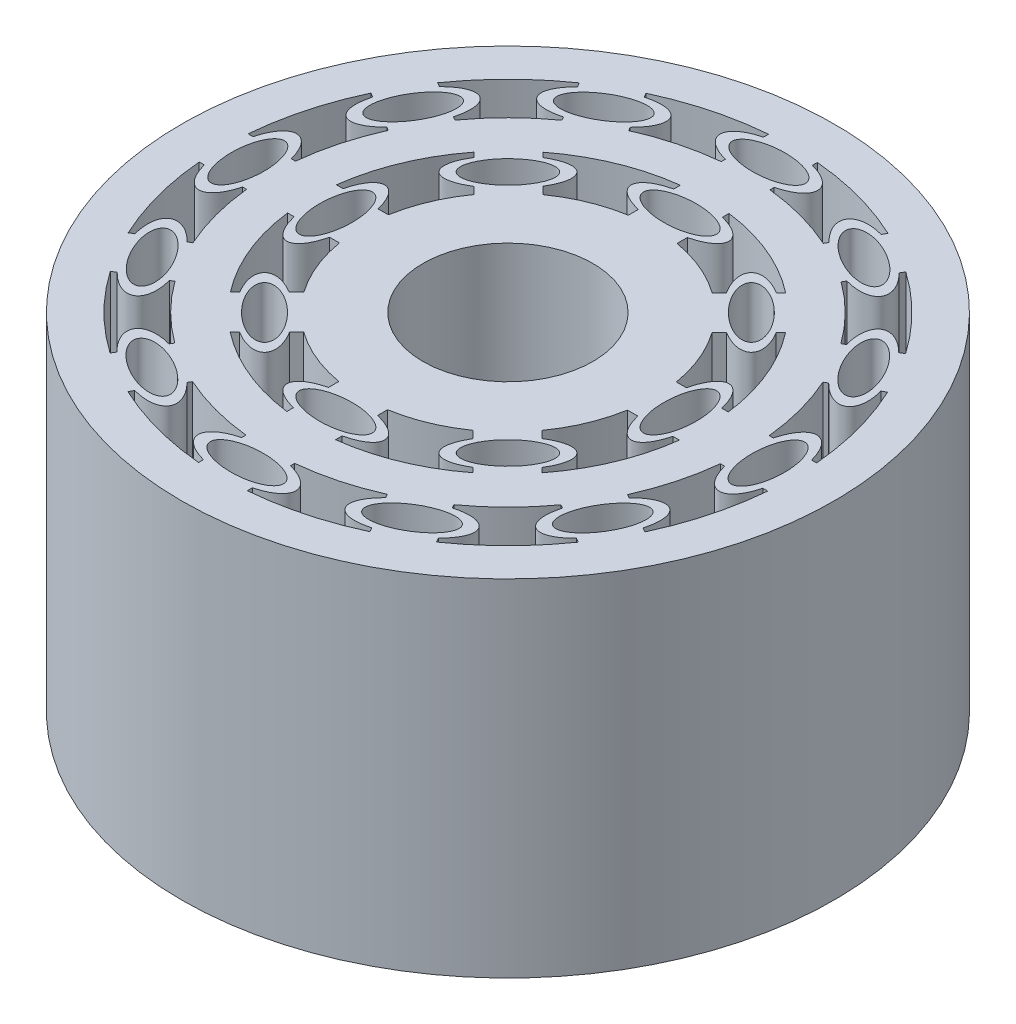
from build123d import *

# Parameters (mm, degrees)
SKETCH1_R            = 40.125
BOSS_EXTRUDE1_DEPTH  = 42.5
SKETCH2_R            = 35.125
CUT_EXTRUDE1_DEPTH   = 71.896271058
SKETCH3_R            = 29.325
BOSS_EXTRUDE2_DEPTH  = 42.5
SKETCH4_R            = 24.325
CUT_EXTRUDE2_DEPTH   = 71.896271058
BOSS_EXTRUDE6_DEPTH  = 42.5
SKETCH10_RX          = 4.5
SKETCH10_RY          = 2
CUT_EXTRUDE4_DEPTH   = 71.896271232
CIRPATTERN11_COUNT   = 12
SKETCH14_R           = 18
BOSS_EXTRUDE7_DEPTH  = 42.5
BOSS_EXTRUDE11_DEPTH = 42.5
SKETCH32_RX          = 4.5
SKETCH32_RY          = 2
CUT_EXTRUDE10_DEPTH  = 71.896271232
CIRPATTERN12_COUNT   = 8
SKETCH33_R           = 10.45
CUT_EXTRUDE11_DEPTH  = 71.896271232
SKETCH34_R           = 11
BOSS_EXTRUDE12_DEPTH = 2


with BuildPart() as part:
    # Sketch1 → Boss-Extrude1 (new body)
    with BuildSketch(Plane(origin=(0, 0, 0), x_dir=(1, 0, 0), z_dir=(0, 1, 0))):
        with Locations(Location((0, 0, 0), (0, 0, 270))):
            Circle(SKETCH1_R)
    extrude(amount=BOSS_EXTRUDE1_DEPTH)

    # Sketch2 → Cut-Extrude1 (cut, through all)
    with BuildSketch(Plane(origin=(0, 42.5, 0), x_dir=(1, 0, 0), z_dir=(0, 1, 0))):
        with Locations(Location((0, 0, 0), (0, 0, 270))):
            Circle(SKETCH2_R)
    extrude(amount=-CUT_EXTRUDE1_DEPTH, mode=Mode.SUBTRACT)



with BuildPart() as body_2:
    # Sketch3 → Boss-Extrude2 (new, through all)
    with BuildSketch(Plane(origin=(0, 0, 0), x_dir=(1, 0, 0), z_dir=(0, 1, 0))):
        with Locations(Location((0, 0, 0), (0, 0, 270))):
            Circle(SKETCH3_R)
    extrude(amount=BOSS_EXTRUDE2_DEPTH)

    # Sketch4 → Cut-Extrude2 (cut, through all)
    with BuildSketch(Plane(origin=(0, 42.5, 0), x_dir=(1, 0, 0), z_dir=(0, 1, 0))):
        with Locations(Location((0, 0, 0), (0, 0, 270))):
            Circle(SKETCH4_R)
    extrude(amount=-CUT_EXTRUDE2_DEPTH, mode=Mode.SUBTRACT)


with BuildPart() as part_1:
    add(part.part)

    add(body_2.part)  # Boss-Extrude6 merges body 2
    # Sketch5 → Boss-Extrude6 (add, through all)
    with BuildSketch(Plane(origin=(0, 42.5, 0), x_dir=(1, 0, 0), z_dir=(0, 1, 0))):
        with BuildLine():
            Line((-2.952538793, 34.381575863), (-2.952538793, 35.744981956))
            Line((-2.952538793, 35.744981956), (3.047461207, 35.744981956))
            Line((3.047461207, 35.744981956), (3.047461207, 34.381575863))
            add(Edge.make_bspline(
                [(3.047461207, 29.683388048), (12.047461207, 32.032481956), (3.047461207, 34.381575863)],
                knots=[2.094395102, 2.094395102, 2.094395102, 4.188790205, 4.188790205, 4.188790205], degree=2, weights=[1, 0.5, 1]))
            Line((3.047461207, 29.683388048), (3.047461207, 28.319981956))
            Line((3.047461207, 28.319981956), (-2.952538793, 28.319981956))
            Line((-2.952538793, 28.319981956), (-2.952538793, 29.683388048))
            add(Edge.make_bspline(
                [(-2.952538793, 34.381575863), (-11.952538793, 32.032481956), (-2.952538793, 29.683388048)],
                knots=[5.235987756, 5.235987756, 5.235987756, 7.330382858, 7.330382858, 7.330382858], degree=2, weights=[1, 0.5, 1]))
        make_face()
    boss_extrude6 = extrude(amount=-BOSS_EXTRUDE6_DEPTH)

    # Sketch10 → Cut-Extrude4 (cut, through all)
    with BuildSketch(Plane(origin=(0, 42.5, 0), x_dir=(1, 0, 0), z_dir=(0, 1, 0))):
        with Locations(Location((0.047461207, 32.032481956), (0, 0, 180))):
            Ellipse(SKETCH10_RX, SKETCH10_RY)
    cut_extrude4 = extrude(amount=-CUT_EXTRUDE4_DEPTH, mode=Mode.SUBTRACT)

    # CirPattern11: Boss-Extrude6, Cut-Extrude4 ×12 about axis
    cirpattern11_axis = Axis((0, 0, 0), (0, -1, 0))
    add([boss_extrude6.rotate(cirpattern11_axis, i * 360 / CIRPATTERN11_COUNT) for i in range(1, CIRPATTERN11_COUNT)])
    add([cut_extrude4.rotate(cirpattern11_axis, i * 360 / CIRPATTERN11_COUNT) for i in range(1, CIRPATTERN11_COUNT)], mode=Mode.SUBTRACT)



with BuildPart() as body_2_2:
    # Sketch14 → Boss-Extrude7 (new body)
    with BuildSketch(Plane(origin=(0, 42.5, 0), x_dir=(1, 0, 0), z_dir=(0, 1, 0))):
        with Locations(Location((0, 0, 0), (0, 0, 270))):
            Circle(SKETCH14_R)
    extrude(amount=-BOSS_EXTRUDE7_DEPTH)


with BuildPart() as part_2:
    add(part_1.part)

    add(body_2_2.part)  # Boss-Extrude11 merges body 2 2
    # Sketch31 → Boss-Extrude11 (add, through all)
    with BuildSketch(Plane(origin=(0, 42.5, 0), x_dir=(1, 0, 0), z_dir=(0, 1, 0))):
        with BuildLine():
            Line((-2.952538793, 25.08628345), (3.047461207, 25.08628345))
            Line((3.047461207, 25.08628345), (3.047461207, 23.316025057))
            add(Edge.make_bspline(
                [(3.047461207, 19.008974943), (11.81311182, 21.1625), (3.047461207, 23.316025057)],
                knots=[2.103553356, 2.103553356, 2.103553356, 4.179631951, 4.179631951, 4.179631951], degree=2, weights=[1, 0.507910201, 1]))
            Line((3.047461207, 19.008974943), (3.047461207, 16.782172776))
            Line((3.047461207, 16.782172776), (-2.952538793, 16.782172776))
            Line((-2.952538793, 16.782172776), (-2.952538793, 18.986138889))
            add(Edge.make_bspline(
                [(-2.952538793, 23.338861111), (-12.192896527, 21.1625), (-2.952538793, 18.986138889)],
                knots=[5.226877675, 5.226877675, 5.226877675, 7.33949294, 7.33949294, 7.33949294], degree=2, weights=[1, 0.492089799, 1]))
            Line((-2.952538793, 23.338861111), (-2.952538793, 25.08628345))
        make_face()
    boss_extrude11 = extrude(amount=-BOSS_EXTRUDE11_DEPTH)

    # Sketch32 → Cut-Extrude10 (cut, through all)
    with BuildSketch(Plane(origin=(0, 42.5, 0), x_dir=(1, 0, 0), z_dir=(0, 1, 0))):
        with Locations(Location((0, 21.1625), (0, 0, 180))):
            Ellipse(SKETCH32_RX, SKETCH32_RY)
    cut_extrude10 = extrude(amount=-CUT_EXTRUDE10_DEPTH, mode=Mode.SUBTRACT)

    # CirPattern12: Boss-Extrude11, Cut-Extrude10 ×8 about axis
    cirpattern12_axis = Axis((0, 0, 0), (0, -1, 0))
    add([boss_extrude11.rotate(cirpattern12_axis, i * 360 / CIRPATTERN12_COUNT) for i in range(1, CIRPATTERN12_COUNT)])
    add([cut_extrude10.rotate(cirpattern12_axis, i * 360 / CIRPATTERN12_COUNT) for i in range(1, CIRPATTERN12_COUNT)], mode=Mode.SUBTRACT)

    # Sketch33 → Cut-Extrude11 (cut, through all)
    with BuildSketch(Plane(origin=(0, 42.5, 0), x_dir=(1, 0, 0), z_dir=(0, 1, 0))):
        with Locations(Location((0, 0, 0), (0, 0, 270))):
            Circle(SKETCH33_R)
    extrude(amount=-CUT_EXTRUDE11_DEPTH, mode=Mode.SUBTRACT)

    # Sketch34 → Boss-Extrude12 (add)
    with BuildSketch(Plane(origin=(0, 0, 0), x_dir=(-1, 0, 0), z_dir=(0, -1, 0))):
        Circle(SKETCH34_R)
    extrude(amount=-BOSS_EXTRUDE12_DEPTH)


solid = part_2.part
